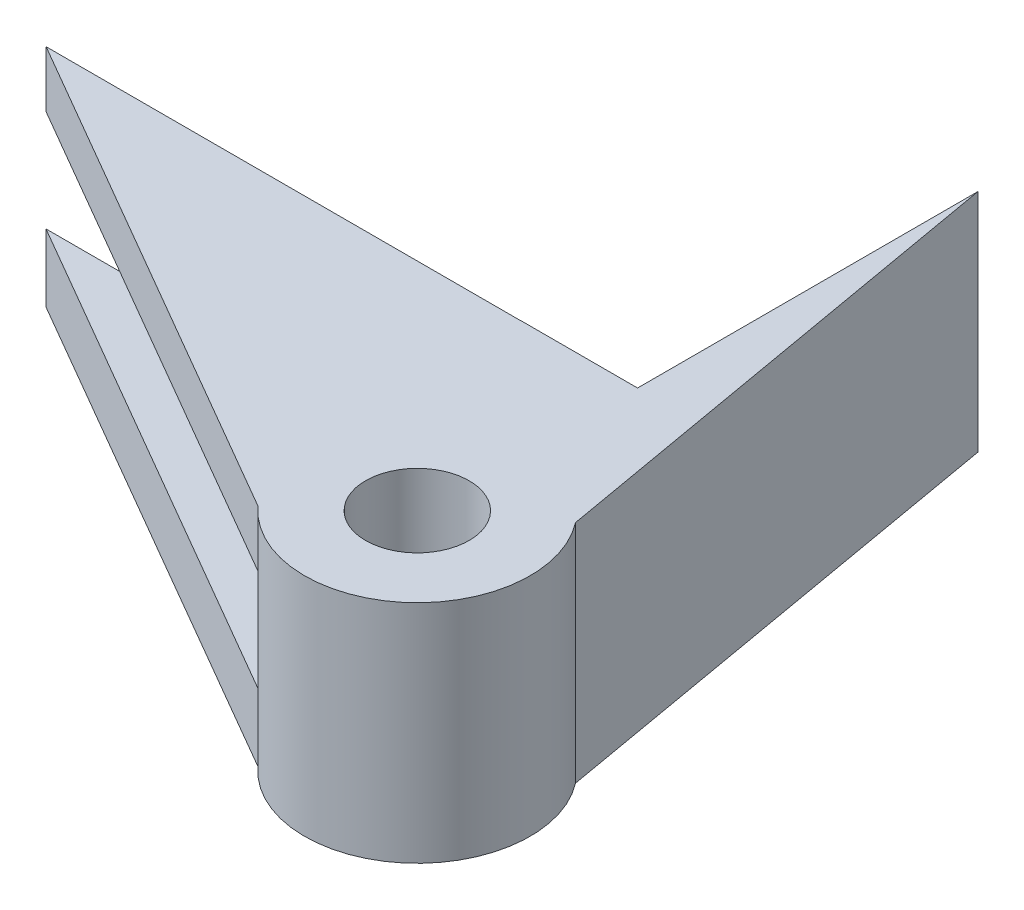
from build123d import *

# Parameters (mm, degrees)
SKETCH1_R           = 4.590078396
BOSS_EXTRUDE1_DEPTH = 6
SKETCH1_3_R         = 4.590078396
BOSS_EXTRUDE2_DEPTH = 20
BOSS_EXTRUDE3_START = -5
BOSS_EXTRUDE3_DEPTH = 5


with BuildPart() as part:
    # Sketch1 → Boss-Extrude1 (new body)
    with BuildSketch(Plane(origin=(0, 0, 0), x_dir=(1, 0, 0), z_dir=(0, 1, 0))):
        with BuildLine():
            Line((38.176629583, -13.072793558), (30.598786144, 30.167258341))
            Line((30.598786144, 30.167258341), (30.598786144, 0))
            Line((30.598786144, 0), (-21.824717568, 0))
            Line((-21.824717568, 0), (22.829214597, -25.872426793))
            ThreePointArc((22.829214597, -25.872426793), (36.654329673, -26.84846253), (38.176629583, -13.072793558))
        make_face()
        with Locations((30.24949737, -19.168740974)):
            Circle(SKETCH1_R, mode=Mode.SUBTRACT)
    extrude(amount=BOSS_EXTRUDE1_DEPTH)

    # Sketch1<3> → Boss-Extrude2 (add)
    with BuildSketch(Plane(origin=(0, 0, 0), x_dir=(1, 0, 0), z_dir=(0, 1, 0))):
        with BuildLine():
            Line((38.176629583, -13.072793558), (30.598786144, 30.167258341))
            Line((30.598786144, 30.167258341), (30.598786144, 0))
            Line((30.598786144, 0), (20.24949737, 0))
            Line((20.24949737, 0), (20.24949737, -19.168740974))
            ThreePointArc((20.24949737, -19.168740974), (33.468866709, -28.636352133), (38.176629583, -13.072793558))
        make_face()
        with Locations((30.24949737, -19.168740974)):
            Circle(SKETCH1_3_R, mode=Mode.SUBTRACT)
    extrude(amount=BOSS_EXTRUDE2_DEPTH)

    # Sketch2 → Boss-Extrude3 (add)
    with BuildSketch(Plane(origin=(0, 20, 0), x_dir=(1, 0, 0), z_dir=(0, 1, 0)).offset(BOSS_EXTRUDE3_START)):
        with BuildLine():
            ThreePointArc((22.829214597, -25.872426793), (20.916683547, -22.760201141), (20.24949737, -19.168740974))
            Line((20.24949737, -19.168740974), (20.24949737, -0.012610588))
            Line((20.24949737, -0.012610588), (-21.802952608, -0.012610588))
            Line((-21.802952608, -0.012610588), (22.829214597, -25.872426793))
        make_face()
    extrude(amount=BOSS_EXTRUDE3_DEPTH)


solid = part.part
